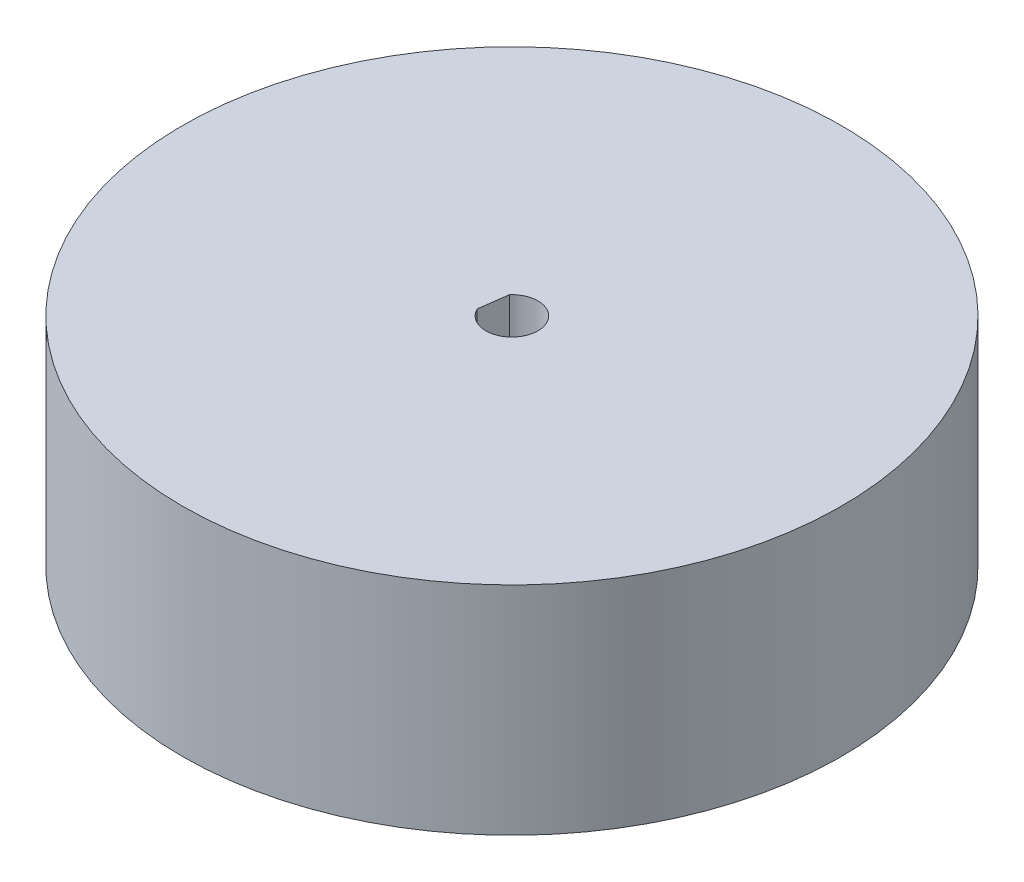
from build123d import *

# Parameters (mm, degrees)
SKETCH1_R               = 38.000051
BOSS_EXTRUDE1_DEPTH     = 25
CUT_EXTRUDE1_DEPTH      = 126.238
CUT_EXTRUDE1_DEPTH_BACK = 113.03


with BuildPart() as part:
    # Sketch1 → Boss-Extrude1 (new body)
    with BuildSketch(Plane(origin=(0, 0, 0), x_dir=(1, 0, 0), z_dir=(0, 1, 0))):
        with Locations(Location((0, 0, 0), (0, 0, 270))):
            Circle(SKETCH1_R)
    extrude(amount=BOSS_EXTRUDE1_DEPTH)

    # Sketch3 → Cut-Extrude1 (cut, two sides: drawn at the far end of the back side and taken through both)
    with BuildSketch(Plane(origin=(-65.296980451, 25, 56.674983696), x_dir=(-0.3902749043377629, 0, 0.9206983757149515), z_dir=(0, 1, 0)).offset(-CUT_EXTRUDE1_DEPTH_BACK)):
        with BuildLine():
            Line((-78.608861351, 35.152566756), (-75.408029079, 36.022863432))
            ThreePointArc((-75.408029079, 36.022863432), (-78.451453042, 40.894900737), (-78.608861351, 35.152566756))
        make_face()
    extrude(amount=CUT_EXTRUDE1_DEPTH + CUT_EXTRUDE1_DEPTH_BACK, mode=Mode.SUBTRACT)


solid = part.part
